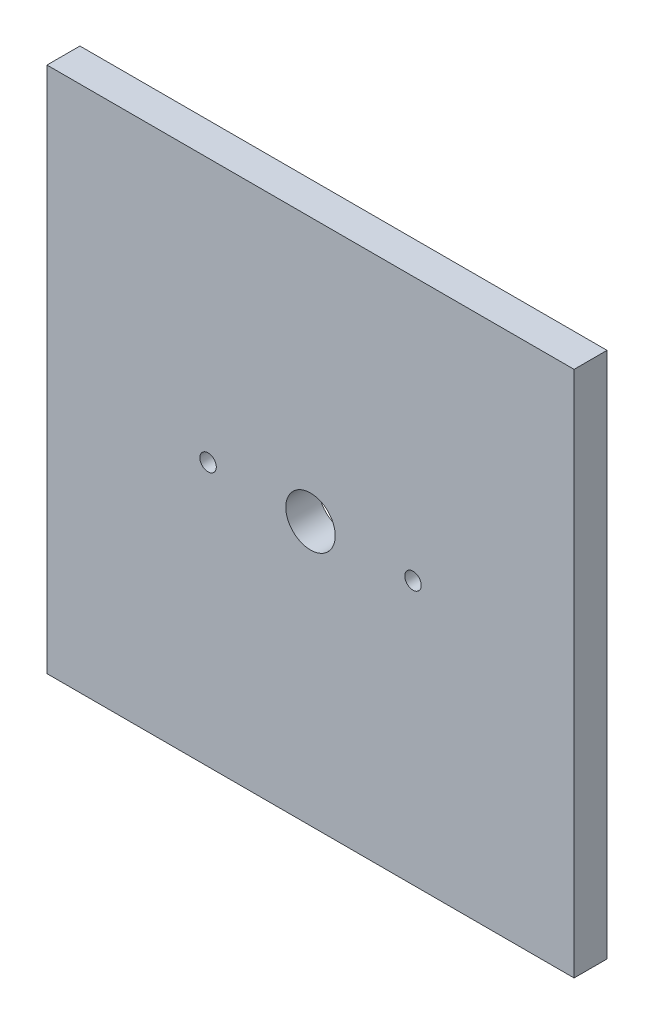
from build123d import *

# Parameters (mm, degrees)
SKETCH1_W           = 203.2
SKETCH1_H           = 203.2
BOSS_EXTRUDE1_DEPTH = 12.7
SKETCH2_R           = 9.525
SKETCH2_R_2         = 3.175
CUT_EXTRUDE1_DEPTH  = 145.244271983


with BuildPart() as part:
    # Sketch1 → Boss-Extrude1 (new body)
    with BuildSketch(Plane.XY):
        Rectangle(SKETCH1_W, SKETCH1_H)
    extrude(amount=BOSS_EXTRUDE1_DEPTH)

    # Sketch2 → Cut-Extrude1 (cut, through all)
    with BuildSketch(Plane.XY.offset(12.7)):
        Circle(SKETCH2_R)
        with Locations((39.497, 0)):
            Circle(SKETCH2_R_2)
        with Locations((-39.497, 0)):
            Circle(SKETCH2_R_2)
    extrude(amount=-CUT_EXTRUDE1_DEPTH, mode=Mode.SUBTRACT)


solid = part.part
